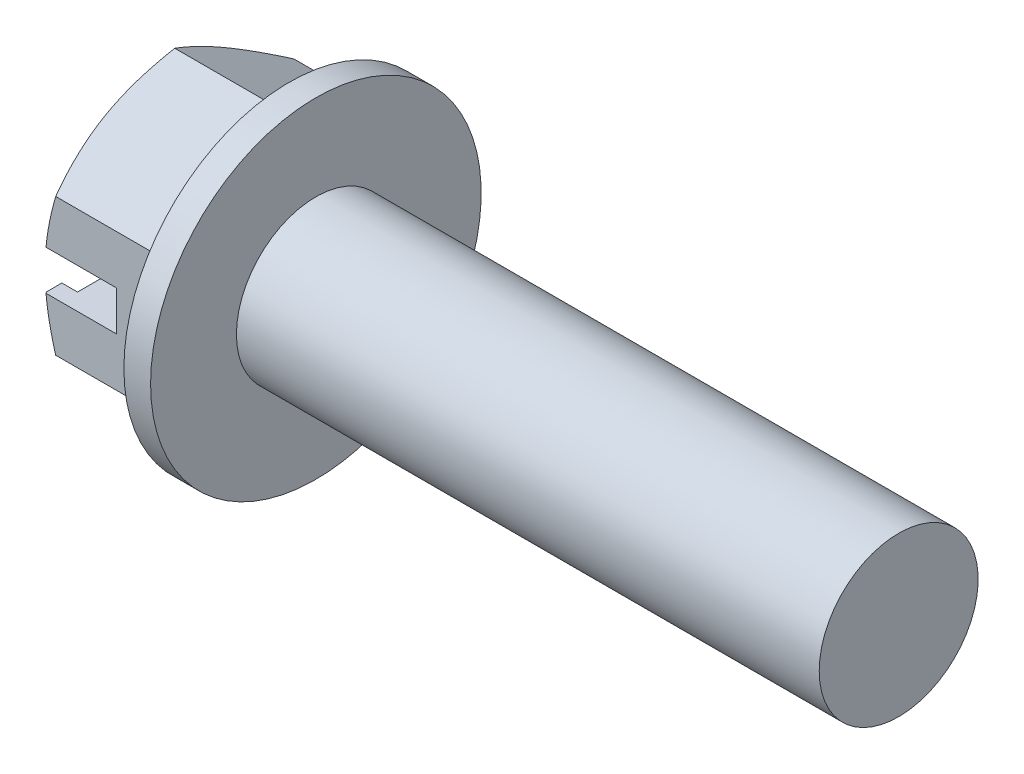
from build123d import *

# Parameters (mm, degrees)
HEX_DIE_START = -2e-06
SKETCH2_R     = 10.00506
HEX_DIE_DEPTH = 7.493002
SKETCH3_W     = 16.483602772
SKETCH3_H     = 2.3876
SLOT_DEPTH    = 4.2672
SKETCH4_R     = 6.245225
INDENT_DEPTH  = 0.936625


with BuildPart() as part:
    # BodySke → Base-Revolve (revolve)
    with BuildSketch(Plane.XY, mode=Mode.PRIVATE) as base_revolve_sk:
        Polygon((9.0932, 4.7625), (9.0932, 9.906), (7.493, 9.906), (7.493, 8.241801386), (0.637626437, 8.241801386), (0, 7.1374), (0, 0), (44.0182, 0), (44.0182, 4.7625), align=None)
    revolve(base_revolve_sk.sketch.rotate(Axis((-25.4, 0, 0), (1, 0, 0)), 90), axis=Axis((-25.4, 0, 0), (1, 0, 0)))

    # Sketch2 → Hex-Die (cut)
    with BuildSketch(Plane(origin=(0, 0, 0), x_dir=(0, 0, -1), z_dir=(1, 0, 0)).offset(HEX_DIE_START)):
        Circle(SKETCH2_R)
        Polygon((-7.1374, 4.120779829), (0, 8.241559659), (7.1374, 4.120779829), (7.1374, -4.120779829), (0, -8.241559659), (-7.1374, -4.120779829), align=None, mode=Mode.SUBTRACT)
    extrude(amount=HEX_DIE_DEPTH, mode=Mode.SUBTRACT)

    # Sketch3 → Slot (cut)
    with BuildSketch(Plane(origin=(0, 0, 0), x_dir=(0, 0, -1), z_dir=(1, 0, 0))):
        Rectangle(SKETCH3_W, SKETCH3_H)
    extrude(amount=SLOT_DEPTH, mode=Mode.SUBTRACT)

    # Sketch4 → Indent (cut)
    with BuildSketch(Plane(origin=(0, 0, 0), x_dir=(0, 0, -1), z_dir=(1, 0, 0))):
        Circle(SKETCH4_R)
    extrude(amount=INDENT_DEPTH, mode=Mode.SUBTRACT)


solid = part.part
